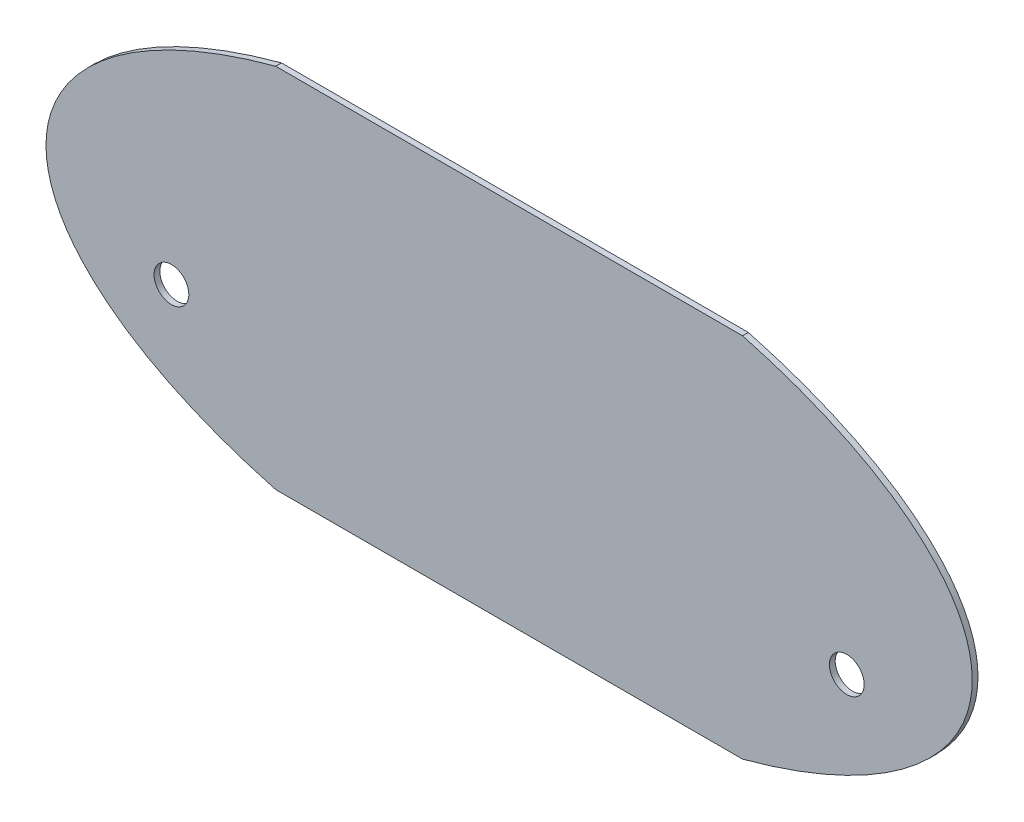
from build123d import *

# Parameters (mm, degrees)
SKETCH1_RX          = 240
SKETCH1_RY          = 110
BOSS_EXTRUDE1_DEPTH = 3
SKETCH12_R          = 9
CUT_EXTRUDE8_DEPTH  = 265.024620064
SKETCH13_W          = 480
SKETCH13_H          = 15
CUT_EXTRUDE9_DEPTH  = 265.024620064


with BuildPart() as part:
    # Sketch1 → Boss-Extrude1 (new body)
    with BuildSketch(Plane.XY):
        with Locations((0, 0)):
            Ellipse(SKETCH1_RX, SKETCH1_RY)
    extrude(amount=-BOSS_EXTRUDE1_DEPTH)

    # Sketch12 → Cut-Extrude8 (cut, through all)
    with BuildSketch(Plane.XY):
        with Locations((175, -30)):
            Circle(SKETCH12_R)
        with Locations(Location((-175, -30, 0), (0, 0, 180))):
            Circle(SKETCH12_R)
    extrude(amount=-CUT_EXTRUDE8_DEPTH, mode=Mode.SUBTRACT)

    # Sketch13 → Cut-Extrude9 (cut, through all)
    with BuildSketch(Plane.XY):
        with Locations((0, -102.5)):
            Rectangle(SKETCH13_W, SKETCH13_H)
        with Locations((0, 102.5)):
            Rectangle(SKETCH13_W, SKETCH13_H)
    extrude(amount=-CUT_EXTRUDE9_DEPTH, mode=Mode.SUBTRACT)


solid = part.part
